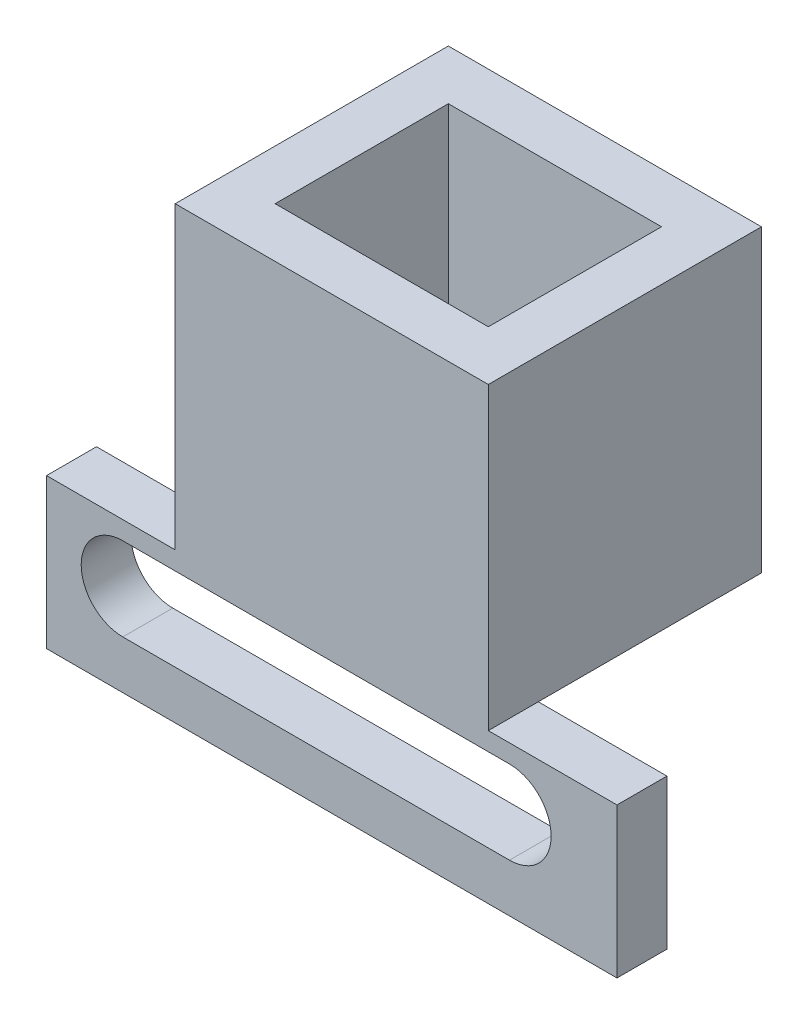
from build123d import *

# Parameters (mm, degrees)
BOSS_EXTRUDE1_DEPTH = 17.85
SKETCH5_R           = 1
CUT_EXTRUDE1_DEPTH  = 10
SKETCH6_W           = 34.25
SKETCH6_H           = 9
BOSS_EXTRUDE2_DEPTH = 3
SKETCH7_W           = 17.85
SKETCH7_H           = 15.1
BOSS_EXTRUDE3_DEPTH = 5.225
BOSS_EXTRUDE4_START = 23.25
SKETCH7_3_W         = 17.85
SKETCH7_3_H         = 15.1
BOSS_EXTRUDE4_DEPTH = 5.225
CUT_EXTRUDE2_REACH  = 125.33
SKETCH8_W           = 7.725
SKETCH8_H           = 18
SKETCH9_W           = 34.25
SKETCH9_H           = 3
BOSS_EXTRUDE5_DEPTH = 18
SKETCH10_W          = 12.8
SKETCH10_H          = 2.9
CUT_EXTRUDE3_DEPTH  = 14.85
CUT_EXTRUDE4_REACH  = 124.932
SKETCH11_W          = 7.725
SKETCH11_H          = 18
SKETCH12_W          = 18.8
SKETCH12_H          = 18
CUT_EXTRUDE5_DEPTH  = 4.45
SKETCH13_W          = 18.8
SKETCH13_H          = 18
BOSS_EXTRUDE6_DEPTH = 3


with BuildPart() as part:
    # Sketch4 → Boss-Extrude1 (new body)
    with BuildSketch(Plane(origin=(0, 0, -70.608208955), x_dir=(-1, 0, 0), z_dir=(0, 0, -1))):
        Polygon((-69.066917791, 81.5), (-45.816917791, 81.5), (-45.816917791, 96.6), (-40.316917791, 96.6), (-40.316917791, 78.6), (-74.566917791, 78.6), (-74.566917791, 96.6), (-69.066917791, 96.6), align=None)
    extrude(amount=BOSS_EXTRUDE1_DEPTH)

    # Sketch5 → Cut-Extrude1 (cut)
    with BuildSketch(Plane(origin=(0, 0, -88.458208955), x_dir=(-1, 0, 0), z_dir=(0, 0, -1))):
        with Locations((-43.741917791, 88)):
            Circle(SKETCH5_R)
        with Locations((-71.141917791, 88)):
            Circle(SKETCH5_R)
    extrude(amount=-CUT_EXTRUDE1_DEPTH, mode=Mode.SUBTRACT)

    # Sketch6 → Boss-Extrude2 (add)
    with BuildSketch(Plane(origin=(0, 0, -70.608208955), x_dir=(-1, 0, 0), z_dir=(0, 0, -1))):
        with Locations((-57.441917791, 74.1)):
            Rectangle(SKETCH6_W, SKETCH6_H)
        with BuildLine():
            Line((-68.111940299, 77.5), (-44.896828216, 77.5))
            ThreePointArc((-44.896828216, 77.5), (-42.396828216, 75), (-44.896828216, 72.5))
            Line((-44.896828216, 72.5), (-68.111940299, 72.5))
            ThreePointArc((-68.111940299, 72.5), (-70.611940299, 75), (-68.111940299, 77.5))
        make_face(mode=Mode.SUBTRACT)
    extrude(amount=BOSS_EXTRUDE2_DEPTH)

    # Sketch7 → Boss-Extrude3 (add)
    with BuildSketch(Plane(origin=(45.816917791, 0, 0), x_dir=(0, 0, -1), z_dir=(1, 0, 0))):
        with Locations((79.533208955, 89.05)):
            Rectangle(SKETCH7_W, SKETCH7_H)
    extrude(amount=BOSS_EXTRUDE3_DEPTH)

    # Sketch7<3> → Boss-Extrude4 (add)
    with BuildSketch(Plane(origin=(45.816917791, 0, 0), x_dir=(0, 0, -1), z_dir=(1, 0, 0)).offset(BOSS_EXTRUDE4_START)):
        with Locations((79.533208955, 89.05)):
            Rectangle(SKETCH7_3_W, SKETCH7_3_H)
    extrude(amount=-BOSS_EXTRUDE4_DEPTH)

    # Sketch8 → Cut-Extrude2 (cut, up to next)
    with BuildSketch(Plane(origin=(0, 0, -88.458208955), x_dir=(-1, 0, 0), z_dir=(0, 0, -1)), mode=Mode.PRIVATE) as cut_extrude2_sk1:
        with Locations((-70.704417791, 87.6)):
            Rectangle(SKETCH8_W, SKETCH8_H)
    cut_extrude2_tool1 = extrude(cut_extrude2_sk1.sketch, amount=-CUT_EXTRUDE2_REACH, mode=Mode.PRIVATE) & part.part
    # Sketch8 → Cut-Extrude2 (cut, up to next)
    with BuildSketch(Plane(origin=(0, 0, -88.458208955), x_dir=(-1, 0, 0), z_dir=(0, 0, -1)), mode=Mode.PRIVATE) as cut_extrude2_sk2:
        with Locations((-44.179417791, 87.6)):
            Rectangle(SKETCH8_W, SKETCH8_H)
    cut_extrude2_tool2 = extrude(cut_extrude2_sk2.sketch, amount=-CUT_EXTRUDE2_REACH, mode=Mode.PRIVATE) & part.part
    add(cut_extrude2_tool1.solids().sort_by_distance((70.704418, 87.6, -88.458209))[0], mode=Mode.SUBTRACT)
    add(cut_extrude2_tool2.solids().sort_by_distance((44.179418, 87.6, -88.458209))[0], mode=Mode.SUBTRACT)

    # Sketch9 → Boss-Extrude5 (add)
    with BuildSketch(Plane(origin=(0, 78.6, 0), x_dir=(1, 0, 0), z_dir=(0, 1, 0))):
        with Locations((57.441917791, 72.108208955)):
            Rectangle(SKETCH9_W, SKETCH9_H)
    extrude(amount=BOSS_EXTRUDE5_DEPTH)

    # Sketch10 → Cut-Extrude3 (cut)
    with BuildSketch(Plane(origin=(0, 0, -88.458208955), x_dir=(-1, 0, 0), z_dir=(0, 0, -1))):
        with Locations((-57.441917791, 80.05)):
            Rectangle(SKETCH10_W, SKETCH10_H)
    extrude(amount=-CUT_EXTRUDE3_DEPTH, mode=Mode.SUBTRACT)

    # Sketch11 → Cut-Extrude4 (cut, up to next)
    with BuildSketch(Plane(origin=(0, 0, -73.608208955), x_dir=(-1, 0, 0), z_dir=(0, 0, -1)), mode=Mode.PRIVATE) as cut_extrude4_sk1:
        with Locations((-70.704417791, 87.6)):
            Rectangle(SKETCH11_W, SKETCH11_H)
    cut_extrude4_tool1 = extrude(cut_extrude4_sk1.sketch, amount=-CUT_EXTRUDE4_REACH, mode=Mode.PRIVATE) & part.part
    # Sketch11 → Cut-Extrude4 (cut, up to next)
    with BuildSketch(Plane(origin=(0, 0, -73.608208955), x_dir=(-1, 0, 0), z_dir=(0, 0, -1)), mode=Mode.PRIVATE) as cut_extrude4_sk2:
        with Locations((-44.179417791, 87.6)):
            Rectangle(SKETCH11_W, SKETCH11_H)
    cut_extrude4_tool2 = extrude(cut_extrude4_sk2.sketch, amount=-CUT_EXTRUDE4_REACH, mode=Mode.PRIVATE) & part.part
    add(cut_extrude4_tool1.solids().sort_by_distance((70.704418, 87.6, -73.608209))[0], mode=Mode.SUBTRACT)
    add(cut_extrude4_tool2.solids().sort_by_distance((44.179418, 87.6, -73.608209))[0], mode=Mode.SUBTRACT)

    # Sketch12 → Cut-Extrude5 (cut)
    with BuildSketch(Plane(origin=(0, 0, -88.458208955), x_dir=(-1, 0, 0), z_dir=(0, 0, -1))):
        with Locations((-57.441917791, 87.6)):
            Rectangle(SKETCH12_W, SKETCH12_H)
    extrude(amount=-CUT_EXTRUDE5_DEPTH, mode=Mode.SUBTRACT)

    # Sketch13 → Boss-Extrude6 (add)
    with BuildSketch(Plane(origin=(0, 0, -84.008208955), x_dir=(-1, 0, 0), z_dir=(0, 0, -1))):
        with Locations((-57.441917791, 87.6)):
            Rectangle(SKETCH13_W, SKETCH13_H)
    extrude(amount=BOSS_EXTRUDE6_DEPTH)


solid = part.part
